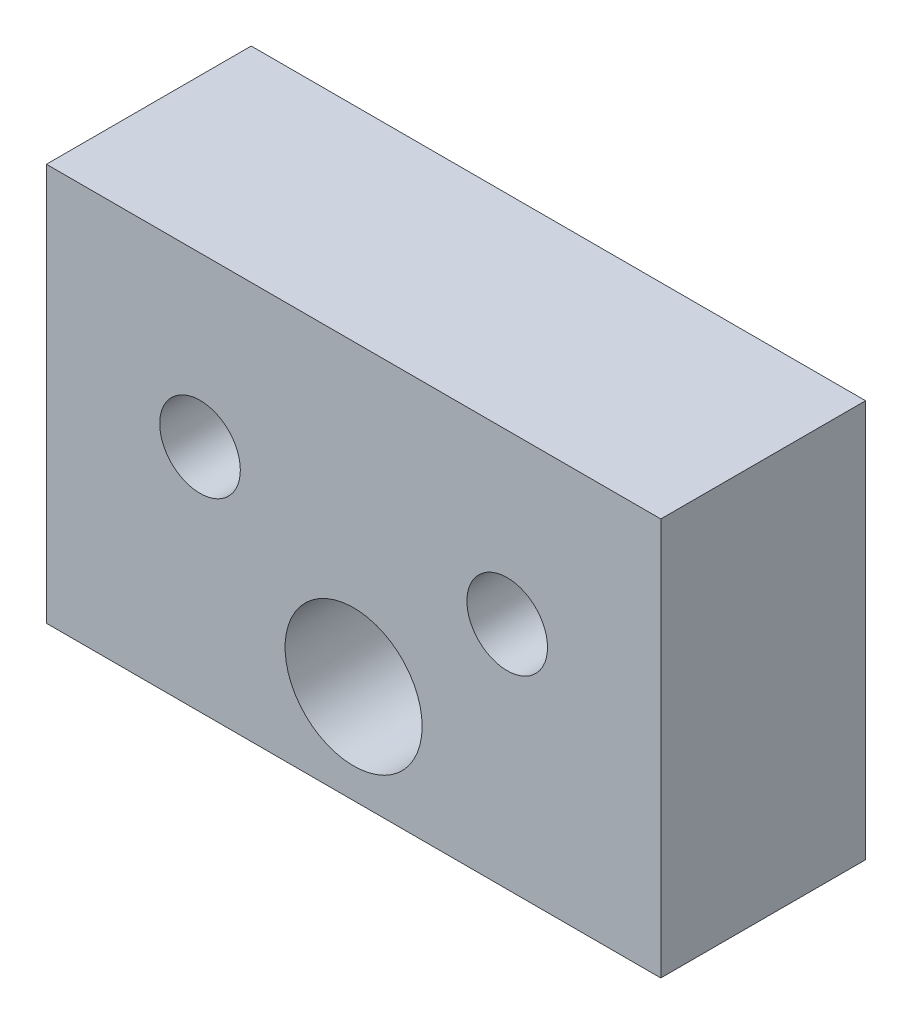
from build123d import *

# Parameters (mm, degrees)
SKETCH1_R           = 5
SKETCH1_R_2         = 8.5
BOSS_EXTRUDE2_DEPTH = 12.7


with BuildPart() as part:
    # Sketch1 → Boss-Extrude2 (new, symmetric)
    with BuildSketch(Plane.XY):
        Polygon((-38.1, 37.084), (38.1, 37.084), (38.1, 12.224), (38.1, -12.224), (-38.1, -12.224), (-38.1, 12.224), align=None)
        with Locations((-19.05, 16.256)):
            Circle(SKETCH1_R, mode=Mode.SUBTRACT)
        with Locations((19.05, 16.256)):
            Circle(SKETCH1_R, mode=Mode.SUBTRACT)
        Circle(SKETCH1_R_2, mode=Mode.SUBTRACT)
    extrude(amount=BOSS_EXTRUDE2_DEPTH, both=True)


solid = part.part
